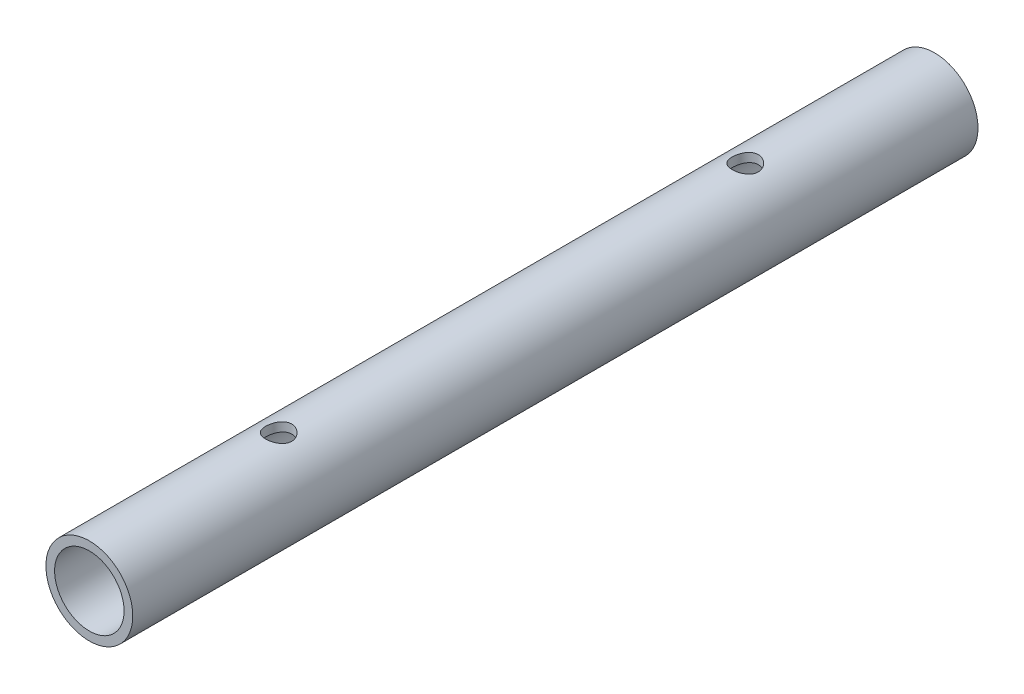
from build123d import *

# Parameters (mm, degrees)
SKETCH1_R               = 5
BOSS_EXTRUDE1_DEPTH     = 97.338
CUT_EXTRUDE1_REACH      = 99.594
SKETCH2_R               = 4
CUT_EXTRUDE2_DEPTH      = 98.594499046
CUT_EXTRUDE2_DEPTH_BACK = 98.594499046
SKETCH5_R               = 1.5


with BuildPart() as part:
    # Sketch1 → Boss-Extrude1 (new body)
    with BuildSketch(Plane.XY):
        Circle(SKETCH1_R)
    extrude(amount=BOSS_EXTRUDE1_DEPTH)

    # Sketch2 → Cut-Extrude1 (cut, up to next)
    with BuildSketch(Plane.XY.offset(97.338), mode=Mode.PRIVATE) as cut_extrude1_sk1:
        Circle(SKETCH2_R)
    cut_extrude1_tool1 = extrude(cut_extrude1_sk1.sketch, amount=-CUT_EXTRUDE1_REACH, mode=Mode.PRIVATE) & part.part
    add(cut_extrude1_tool1.solids().sort_by_distance((0, 0, 97.338))[0], mode=Mode.SUBTRACT)

    # Sketch5 → Cut-Extrude2 (cut, two sides: drawn at the far end of the back side and taken through both)
    with BuildSketch(Plane(origin=(0, 0, 0), x_dir=(1, 0, 0), z_dir=(0, 1, 0)).offset(-CUT_EXTRUDE2_DEPTH_BACK)):
        with Locations(Location((0, -21.804, 0), (0, 0, 270))):
            Circle(SKETCH5_R)
        with Locations(Location((0, -75.534, 0), (0, 0, 270))):
            Circle(SKETCH5_R)
    extrude(amount=CUT_EXTRUDE2_DEPTH + CUT_EXTRUDE2_DEPTH_BACK, mode=Mode.SUBTRACT)


solid = part.part
